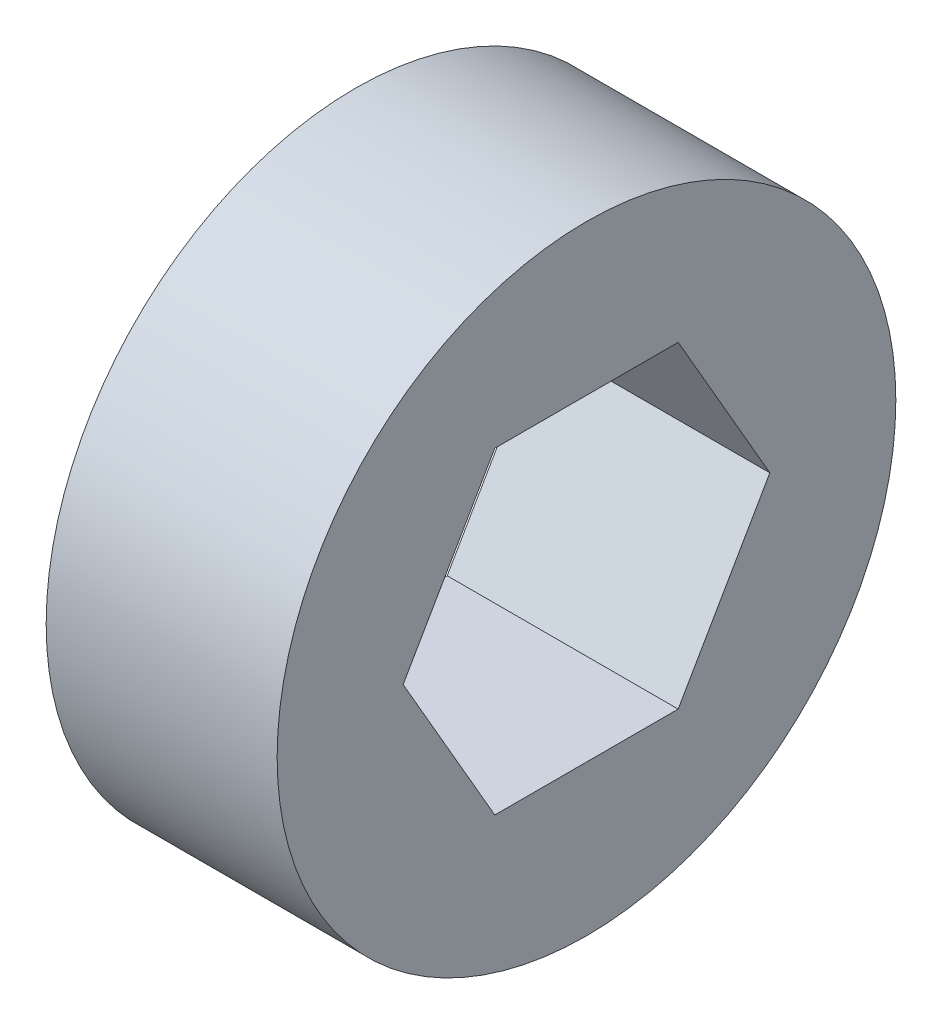
from build123d import *

# Parameters (mm, degrees)
SKETCH1_R           = 9.525
BOSS_EXTRUDE1_DEPTH = 7.112


with BuildPart() as part:
    # Sketch1 → Boss-Extrude1 (new body)
    with BuildSketch(Plane(origin=(0, 0, 0), x_dir=(0, 0, -1), z_dir=(1, 0, 0))):
        Circle(SKETCH1_R)
        Polygon((5.645908282, 0), (2.822954141, 4.8895), (-2.822954141, 4.8895), (-5.645908282, 0), (-2.822954141, -4.8895), (2.822954141, -4.8895), align=None, mode=Mode.SUBTRACT)
    extrude(amount=BOSS_EXTRUDE1_DEPTH)


solid = part.part
